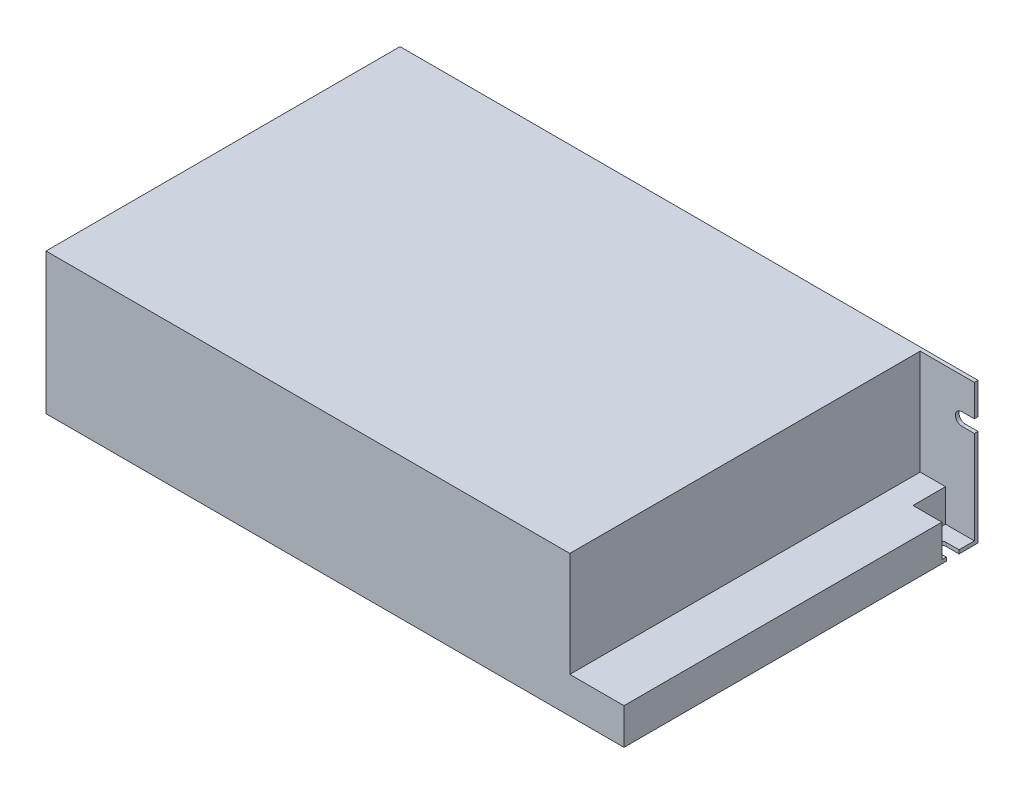
from build123d import *

# Parameters (mm, degrees)
SKETCH_1_W          = 160
SKETCH_1_H          = 98
EXTRUDE_1_DEPTH     = 39
SKETCH_2_W          = 97
SKETCH_2_H          = 29
CUT_EXTRUDE_1_DEPTH = 15
SKETCH_3_R          = 1.75
CUT_EXTRUDE_2_DEPTH = 5
SKETCH_4_R          = 1.75
CUT_EXTRUDE_3_DEPTH = 5
SKETCH_5_W          = 8
SKETCH_5_H          = 9
CUT_EXTRUDE_4_DEPTH = 9


with BuildPart() as part:
    # 草图1 → 拉伸1 (new body)
    with BuildSketch(Plane(origin=(0, 0, 0), x_dir=(1, 0, 0), z_dir=(0, 1, 0))):
        Rectangle(SKETCH_1_W, SKETCH_1_H)
    extrude(amount=EXTRUDE_1_DEPTH)

    # 草图2 → 切除-拉伸1 (cut)
    with BuildSketch(Plane(origin=(80, 0, 0), x_dir=(0, 0, -1), z_dir=(1, 0, 0))):
        with Locations((-0.5, 24.5)):
            Rectangle(SKETCH_2_W, SKETCH_2_H)
    extrude(amount=-CUT_EXTRUDE_1_DEPTH, mode=Mode.SUBTRACT)

    # 草图3 → 切除-拉伸2 (cut)
    with BuildSketch(Plane(origin=(0, 0, -49), x_dir=(-1, 0, 0), z_dir=(0, 0, -1))):
        with Locations((-59, 28.5)):
            Circle(SKETCH_3_R)
        with Locations((73.5, 28.5)):
            Circle(SKETCH_3_R)
        with Locations((58, 19)):
            Circle(SKETCH_3_R)
        with Locations((-59, 10.5)):
            Circle(SKETCH_3_R)
        with BuildLine():
            Line((-76.5, 30.25), (-80, 30.25))
            Line((-80, 30.25), (-80, 26.75))
            Line((-80, 26.75), (-76.5, 26.75))
            ThreePointArc((-76.5, 26.75), (-74.75, 28.5), (-76.5, 30.25))
        make_face()
    extrude(amount=-CUT_EXTRUDE_2_DEPTH, mode=Mode.SUBTRACT)

    # 草图4 → 切除-拉伸3 (cut)
    with BuildSketch(Plane.XZ):
        with Locations(Location((22, -16, 0), (0, 0, 270))):
            Circle(SKETCH_4_R)
        with Locations(Location((22, 16, 0), (0, 0, 270))):
            Circle(SKETCH_4_R)
        with Locations(Location((-56, -16, 0), (0, 0, 270))):
            Circle(SKETCH_4_R)
        with Locations(Location((-56, 16, 0), (0, 0, 270))):
            Circle(SKETCH_4_R)
        with Locations(Location((-75.5, 43.5, 0), (0, 0, 270))):
            Circle(SKETCH_4_R)
        with BuildLine():
            Line((76.5, -43.75), (80, -43.75))
            Line((80, -43.75), (80, -40.25))
            Line((80, -40.25), (76.5, -40.25))
            ThreePointArc((76.5, -40.25), (74.75, -42), (76.5, -43.75))
        make_face()
    extrude(amount=-CUT_EXTRUDE_3_DEPTH, mode=Mode.SUBTRACT)

    # 草图5 → 切除-拉伸4 (cut)
    with BuildSketch(Plane(origin=(0, 10, 0), x_dir=(-1, 0, 0), z_dir=(0, 1, 0))):
        with Locations((-76, -43.5)):
            Rectangle(SKETCH_5_W, SKETCH_5_H)
    extrude(amount=-CUT_EXTRUDE_4_DEPTH, mode=Mode.SUBTRACT)


solid = part.part
